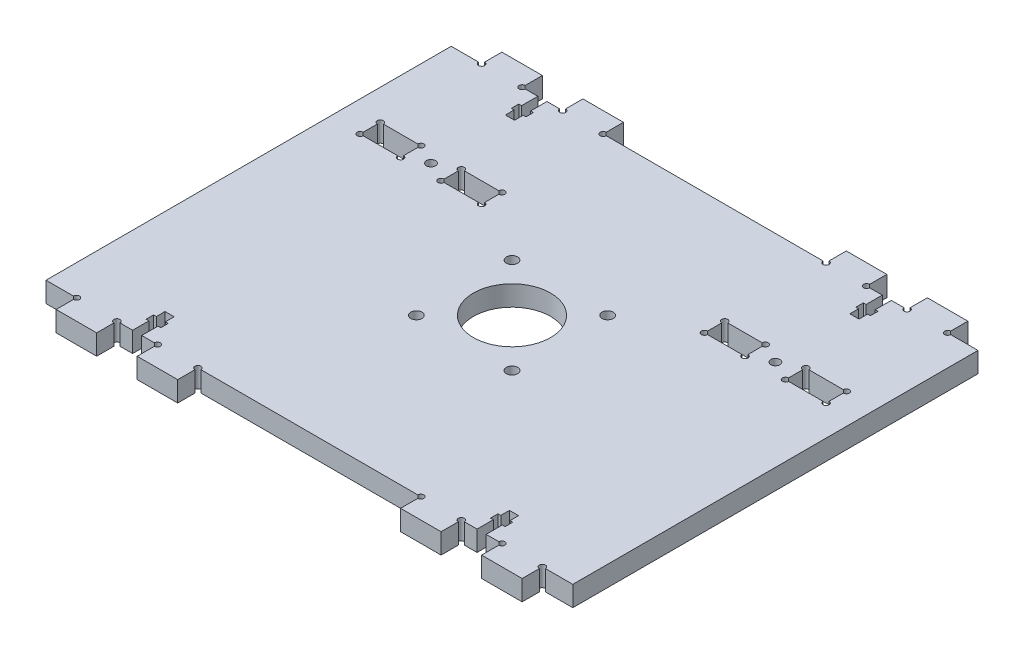
from build123d import *

# Parameters (mm, degrees)
SKETCH1_W            = 260
SKETCH1_H            = 200
EXTRUDE1_DEPTH       = 10
SKETCH3_W            = 20
SKETCH3_H            = 10
EXTRUDE2_DEPTH       = 10
M4_CLEARANCE_HOLE1_D = 4.5
EXTRUDE3_DEPTH       = 10
MIRROR2_COPY_1_DEPTH = 10
MIRROR3_COPY_1_DEPTH = 10
MIRROR3_COPY_2_DEPTH = 10
MIRROR3_COPY_3_DEPTH = 10
SKETCH7_W            = 20
SKETCH7_H            = 10
EXTRUDE4_DEPTH       = 10
LPATTERN1_COUNT      = 2
LPATTERN1_PITCH      = 170
LPATTERN1_COUNT_DIR2 = 2
LPATTERN1_PITCH_DIR2 = 210
EXTRUDE5_DEPTH       = 10
MIRROR5_COPY_1_DEPTH = 10
EXTRUDE6_DEPTH       = 10
MIRROR7_COPY_1_DEPTH = 10
SKETCH11_R           = 19.05
SKETCH11_R_2         = 2.75
CUT_EXTRUDE2_DEPTH   = 10


with BuildPart() as part:
    # Sketch1 → Extrude1 (new body)
    with BuildSketch(Plane(origin=(0, 0, 0), x_dir=(1, 0, 0), z_dir=(0, 1, 0))):
        Rectangle(SKETCH1_W, SKETCH1_H)
    extrude(amount=EXTRUDE1_DEPTH)

    # Sketch3 → Extrude2 (cut)
    with BuildSketch(Plane(origin=(0, 10, 0), x_dir=(1, 0, 0), z_dir=(0, 1, 0))):
        with Locations((-105, 45)):
            Rectangle(SKETCH3_W, SKETCH3_H)
        with Locations((105, 45)):
            Rectangle(SKETCH3_W, SKETCH3_H)
        with Locations((-65, 45)):
            Rectangle(SKETCH3_W, SKETCH3_H)
        with Locations((65, 45)):
            Rectangle(SKETCH3_W, SKETCH3_H)
    extrude(amount=-EXTRUDE2_DEPTH, mode=Mode.SUBTRACT)

    # M4 Clearance Hole1 (through all)
    with Locations(Plane(origin=(0, 10, 0), x_dir=(1, 0, 0), z_dir=(0, 1, 0))):
        with Locations((-85, 45), (85, 45)):
            Hole(M4_CLEARANCE_HOLE1_D / 2)

    # Sketch6 → Extrude3 (cut)
    with BuildSketch(Plane(origin=(0, 10, 0), x_dir=(1, 0, 0), z_dir=(0, 1, 0))):
        with BuildLine():
            Line((-113.5, 50), (-115, 50))
            Line((-115, 50), (-115, 48.5))
            ThreePointArc((-115, 48.5), (-116.060660172, 51.060660172), (-113.5, 50))
        make_face()
        with BuildLine():
            Line((-113.5, 40), (-115, 40))
            Line((-115, 40), (-115, 41.5))
            ThreePointArc((-115, 41.5), (-116.060660172, 38.939339828), (-113.5, 40))
        make_face()
    extrude3 = extrude(amount=-EXTRUDE3_DEPTH, mode=Mode.SUBTRACT)

    # Mirror1: Extrude3 across plane
    add(extrude3.mirror(Plane(origin=(-105, 0, 0), x_dir=(0, 0, 1), z_dir=(1, 0, 0))), mode=Mode.SUBTRACT)

    # Mirror2: Extrude3 across plane
    add(extrude3.mirror(Plane.ZY.offset(85)), mode=Mode.SUBTRACT)

    # Mirror2 copy 1 sketch → Mirror2 copy 1 (cut)
    with BuildSketch(Plane(origin=(40, 10, 0), x_dir=(1, 0, 0), z_dir=(0, 1, 0))):
        with BuildLine():
            Line((-113.5, 50), (-115, 50))
            Line((-115, 50), (-115, 48.5))
            ThreePointArc((-115, 48.5), (-116.060660172, 51.060660172), (-113.5, 50))
        make_face()
        with BuildLine():
            Line((-113.5, 40), (-115, 40))
            Line((-115, 40), (-115, 41.5))
            ThreePointArc((-115, 41.5), (-116.060660172, 38.939339828), (-113.5, 40))
        make_face()
    extrude(amount=-MIRROR2_COPY_1_DEPTH, mode=Mode.SUBTRACT)

    # Mirror3: Extrude3 across plane
    add(extrude3.mirror(Plane(origin=(0, 0, 0), x_dir=(0, 0, 1), z_dir=(1, 0, 0))), mode=Mode.SUBTRACT)

    # Mirror3 copy 1 sketch → Mirror3 copy 1 (cut)
    with BuildSketch(Plane(origin=(210, 10, 0), x_dir=(1, 0, 0), z_dir=(0, 1, 0))):
        with BuildLine():
            Line((-113.5, 50), (-115, 50))
            Line((-115, 50), (-115, 48.5))
            ThreePointArc((-115, 48.5), (-116.060660172, 51.060660172), (-113.5, 50))
        make_face()
        with BuildLine():
            Line((-113.5, 40), (-115, 40))
            Line((-115, 40), (-115, 41.5))
            ThreePointArc((-115, 41.5), (-116.060660172, 38.939339828), (-113.5, 40))
        make_face()
    extrude(amount=-MIRROR3_COPY_1_DEPTH, mode=Mode.SUBTRACT)

    # Mirror3 copy 2 sketch → Mirror3 copy 2 (cut)
    with BuildSketch(Plane(origin=(170, 10, 0), x_dir=(1, 0, 0), z_dir=(0, 1, 0))):
        with BuildLine():
            Line((-113.5, 50), (-115, 50))
            Line((-115, 50), (-115, 48.5))
            ThreePointArc((-115, 48.5), (-116.060660172, 51.060660172), (-113.5, 50))
        make_face()
        with BuildLine():
            Line((-113.5, 40), (-115, 40))
            Line((-115, 40), (-115, 41.5))
            ThreePointArc((-115, 41.5), (-116.060660172, 38.939339828), (-113.5, 40))
        make_face()
    extrude(amount=-MIRROR3_COPY_2_DEPTH, mode=Mode.SUBTRACT)

    # Mirror3 copy 3 sketch → Mirror3 copy 3 (cut)
    with BuildSketch(Plane(origin=(-40, 10, 0), x_dir=(-1, 0, 0), z_dir=(0, 1, 0))):
        with BuildLine():
            Line((-113.5, -50), (-115, -50))
            Line((-115, -50), (-115, -48.5))
            ThreePointArc((-115, -48.5), (-116.060660172, -51.060660172), (-113.5, -50))
        make_face()
        with BuildLine():
            Line((-113.5, -40), (-115, -40))
            Line((-115, -40), (-115, -41.5))
            ThreePointArc((-115, -41.5), (-116.060660172, -38.939339828), (-113.5, -40))
        make_face()
    extrude(amount=-MIRROR3_COPY_3_DEPTH, mode=Mode.SUBTRACT)

    # Sketch7 → Extrude4 (add)
    with BuildSketch(Plane(origin=(0, 10, 0), x_dir=(1, 0, 0), z_dir=(0, 1, 0))):
        with Locations((-105, -105)):
            Rectangle(SKETCH7_W, SKETCH7_H)
        with Locations((-65, -105)):
            Rectangle(SKETCH7_W, SKETCH7_H)
    extrude4 = extrude(amount=-EXTRUDE4_DEPTH)

    # LPattern1: Extrude4 2 × 2
    with Locations(*[(i * LPATTERN1_PITCH, 0, -j * LPATTERN1_PITCH_DIR2) for i in range(LPATTERN1_COUNT) for j in range(LPATTERN1_COUNT_DIR2) if (i, j) != (0, 0)]):
        add(extrude4)

    # Sketch8 → Extrude5 (cut)
    with BuildSketch(Plane(origin=(0, 10, 0), x_dir=(1, 0, 0), z_dir=(0, 1, 0))):
        with BuildLine():
            Line((-116.5, -100), (-115, -100))
            Line((-115, -100), (-115, -101.5))
            ThreePointArc((-115, -101.5), (-113.939339828, -98.939339828), (-116.5, -100))
        make_face()
        with BuildLine():
            Line((-95, -101.5), (-95, -100))
            Line((-95, -100), (-93.5, -100))
            ThreePointArc((-93.5, -100), (-96.060660172, -98.939339828), (-95, -101.5))
        make_face()
        with BuildLine():
            Line((-75, -100), (-75, -101.5))
            ThreePointArc((-75, -101.5), (-73.939339828, -98.939339828), (-76.5, -100))
            Line((-76.5, -100), (-75, -100))
        make_face()
        with BuildLine():
            Line((-55, -101.5), (-55, -100))
            Line((-55, -100), (-53.5, -100))
            ThreePointArc((-53.5, -100), (-56.060660172, -98.939339828), (-55, -101.5))
        make_face()
    extrude5 = extrude(amount=-EXTRUDE5_DEPTH, mode=Mode.SUBTRACT)

    # Mirror4: Extrude5 across plane
    add(extrude5.mirror(Plane(origin=(0, 0, 0), x_dir=(0, 0, 1), z_dir=(1, 0, 0))), mode=Mode.SUBTRACT)

    # Mirror5: Extrude5 across plane
    add(extrude5.mirror(Plane.XY), mode=Mode.SUBTRACT)

    # Mirror5 copy 1 sketch → Mirror5 copy 1 (cut)
    with BuildSketch(Plane(origin=(0, 10, 0), x_dir=(-1, 0, 0), z_dir=(0, 1, 0))):
        with BuildLine():
            Line((-116.5, -100), (-115, -100))
            Line((-115, -100), (-115, -101.5))
            ThreePointArc((-115, -101.5), (-113.939339828, -98.939339828), (-116.5, -100))
        make_face()
        with BuildLine():
            Line((-95, -101.5), (-95, -100))
            Line((-95, -100), (-93.5, -100))
            ThreePointArc((-93.5, -100), (-96.060660172, -98.939339828), (-95, -101.5))
        make_face()
        with BuildLine():
            Line((-75, -100), (-75, -101.5))
            ThreePointArc((-75, -101.5), (-73.939339828, -98.939339828), (-76.5, -100))
            Line((-76.5, -100), (-75, -100))
        make_face()
        with BuildLine():
            Line((-55, -101.5), (-55, -100))
            Line((-55, -100), (-53.5, -100))
            ThreePointArc((-53.5, -100), (-56.060660172, -98.939339828), (-55, -101.5))
        make_face()
    extrude(amount=-MIRROR5_COPY_1_DEPTH, mode=Mode.SUBTRACT)

    # Sketch9 → Extrude6 (cut)
    with BuildSketch(Plane(origin=(0, 10, 0), x_dir=(1, 0, 0), z_dir=(0, 1, 0))):
        Polygon((-87.25, -100), (-87.25, -92), (-88.625, -92), (-88.625, -88.3), (-87.25, -88.3), (-87.25, -84), (-82.75, -84), (-82.75, -88.3), (-81.375, -88.3), (-81.375, -92), (-82.75, -92), (-82.75, -100), align=None)
    extrude6 = extrude(amount=-EXTRUDE6_DEPTH, mode=Mode.SUBTRACT)

    # Mirror6: Extrude6 across plane
    add(extrude6.mirror(Plane(origin=(0, 0, 0), x_dir=(0, 0, 1), z_dir=(1, 0, 0))), mode=Mode.SUBTRACT)

    # Mirror7: Extrude6 across plane
    add(extrude6.mirror(Plane.XY), mode=Mode.SUBTRACT)

    # Mirror7 copy 1 sketch → Mirror7 copy 1 (cut)
    with BuildSketch(Plane(origin=(0, 10, 0), x_dir=(-1, 0, 0), z_dir=(0, 1, 0))):
        Polygon((-87.25, -100), (-87.25, -92), (-88.625, -92), (-88.625, -88.3), (-87.25, -88.3), (-87.25, -84), (-82.75, -84), (-82.75, -88.3), (-81.375, -88.3), (-81.375, -92), (-82.75, -92), (-82.75, -100), align=None)
    extrude(amount=-MIRROR7_COPY_1_DEPTH, mode=Mode.SUBTRACT)

    # Sketch11 → Cut-Extrude2 (cut)
    with BuildSketch(Plane(origin=(-130, 0, 110), x_dir=(0, 0, 1), z_dir=(0, -1, 0))):
        with Locations(Location((-110, -130, 0), (0, 0, 180))):
            Circle(SKETCH11_R)
        with Locations(Location((-133.6, -106.4, 0), (0, 0, 180))):
            Circle(SKETCH11_R_2)
        with Locations(Location((-133.6, -153.6, 0), (0, 0, 180))):
            Circle(SKETCH11_R_2)
        with Locations(Location((-86.4, -153.6, 0), (0, 0, 180))):
            Circle(SKETCH11_R_2)
        with Locations(Location((-86.4, -106.4, 0), (0, 0, 180))):
            Circle(SKETCH11_R_2)
    extrude(amount=-CUT_EXTRUDE2_DEPTH, mode=Mode.SUBTRACT)


solid = part.part
